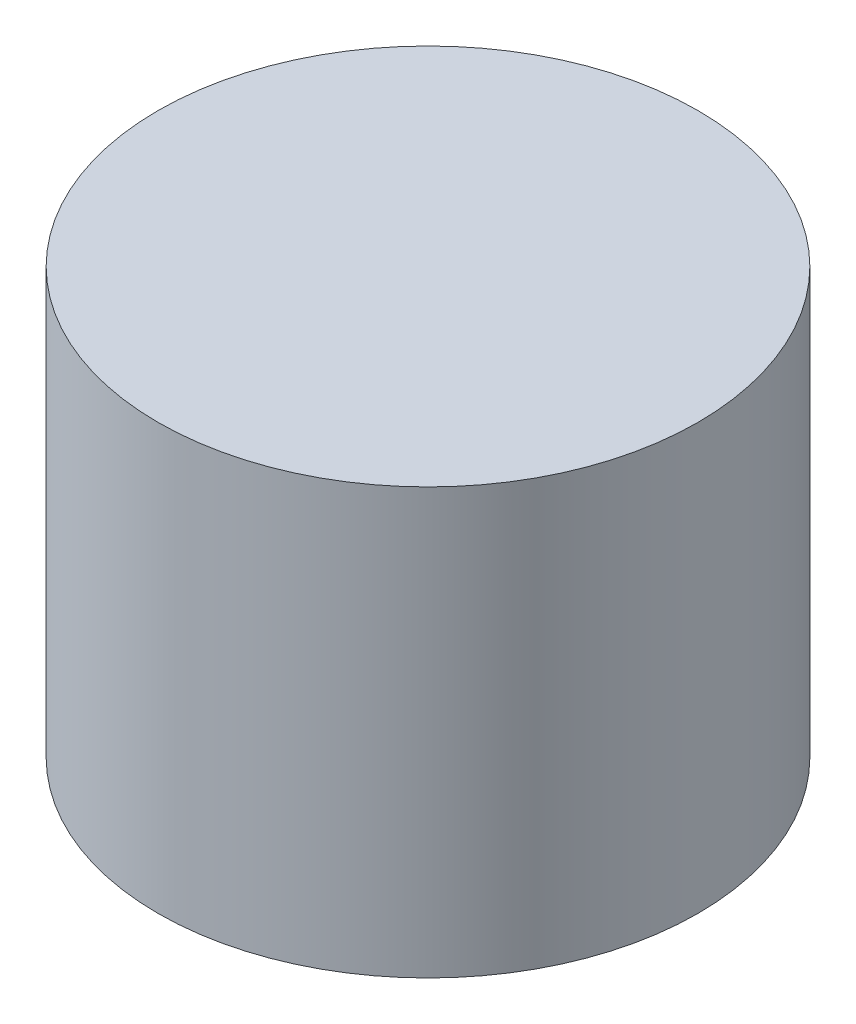
from build123d import *


with BuildPart() as part:
    # Sketch1 → Revolve1 (revolve)
    with BuildSketch(Plane.XY, mode=Mode.PRIVATE) as revolve1_sk:
        Polygon((0, 0), (1, 0), (1, -1.52), (1.6, -1.52), (1.6, 1), (0, 1), align=None)
    revolve(revolve1_sk.sketch.rotate(Axis((0, 1, 0), (0, -1, 0)), 90), axis=Axis((0, 1, 0), (0, -1, 0)))


solid = part.part
